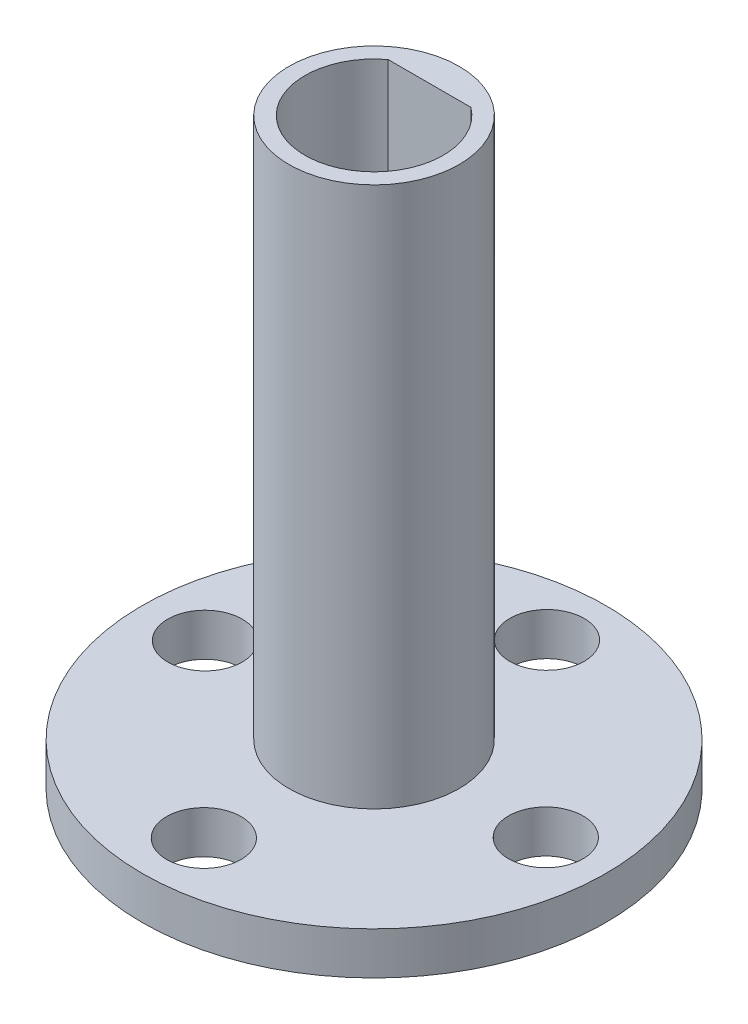
from build123d import *

# Parameters (mm, degrees)
SKETCH3_R           = 4
BOSS_EXTRUDE1_DEPTH = 27.4
SKETCH3_17_R        = 10.9
SKETCH3_17_R_2      = 1.75
BOSS_EXTRUDE2_DEPTH = 2


with BuildPart() as part:
    # Sketch3 → Boss-Extrude1 (new body)
    with BuildSketch(Plane(origin=(0, 0, 0), x_dir=(1, 0, 0), z_dir=(0, 1, 0))):
        Circle(SKETCH3_R)
        with BuildLine():
            Line((-1.942645776, 2.605499451), (1.942645776, 2.605499451))
            ThreePointArc((1.942645776, 2.605499451), (0, -3.25), (-1.942645776, 2.605499451))
        make_face(mode=Mode.SUBTRACT)
    extrude(amount=BOSS_EXTRUDE1_DEPTH)

    # Sketch3<17> → Boss-Extrude2 (add)
    with BuildSketch(Plane(origin=(0, 0, 0), x_dir=(1, 0, 0), z_dir=(0, 1, 0))):
        Circle(SKETCH3_17_R)
        with Locations((0.009034474, 8.115584077)):
            Circle(SKETCH3_17_R_2, mode=Mode.SUBTRACT)
        with Locations((8.017679827, 0.053335715)):
            Circle(SKETCH3_17_R_2, mode=Mode.SUBTRACT)
        with Locations((0.009179949, -8.009057152)):
            Circle(SKETCH3_17_R_2, mode=Mode.SUBTRACT)
        with Locations((-7.999465404, 0.05319121)):
            Circle(SKETCH3_17_R_2, mode=Mode.SUBTRACT)
    extrude(amount=BOSS_EXTRUDE2_DEPTH)


solid = part.part
